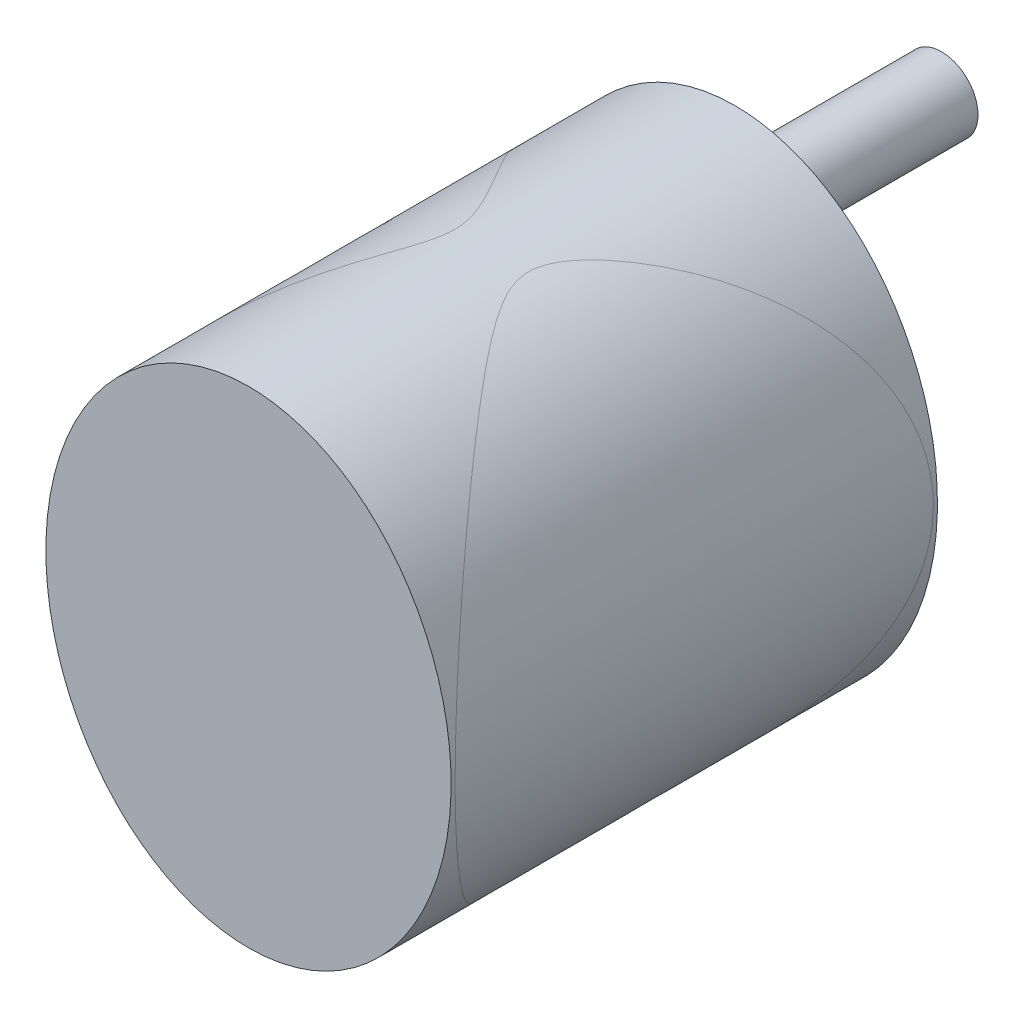
from build123d import *

# Parameters (mm, degrees)
ESQUISSE1_RX                 = 3
ESQUISSE1_RY                 = 2.5
EXTRUSION1_DEPTH             = 6
FRACTIONNER3_SURFACE_1_BACK  = 10.849
FRACTIONNER3_SURFACE_1_DEPTH = 21.698
FRACTIONNER3_SURFACE_2_BACK  = 10.849
FRACTIONNER3_SURFACE_2_DEPTH = 21.698
EXTRUSION3_REACH             = 10.902
ESQUISSE3_R                  = 0.45


with BuildPart() as part:
    # Esquisse1 → Extrusion1 (new body)
    with BuildSketch(Plane.XY):
        with Locations(Location((0, 0), (0, 0, 90))):
            Ellipse(ESQUISSE1_RX, ESQUISSE1_RY)
    extrude(amount=EXTRUSION1_DEPTH)


with BuildPart() as body_2:
    # Fractionner3: the piece behind the surface
    add(part.part)
    # Fractionner3 surface: a surface, the sketch's curves swept straight by 21.698 mm
    with BuildLine(Plane(origin=(0, 0, 0), x_dir=(0, 0, -1), z_dir=(1, 0, 0)).offset(-FRACTIONNER3_SURFACE_1_BACK), mode=Mode.PRIVATE) as fractionner3_surface_1_path:
        CenterArc((-3, 0), 2.95, 0, 360)
    fractionner3_surface_1 = Shell.extrude(fractionner3_surface_1_path.wire(), (1 * FRACTIONNER3_SURFACE_1_DEPTH, 0 * FRACTIONNER3_SURFACE_1_DEPTH, 0 * FRACTIONNER3_SURFACE_1_DEPTH))
    split(bisect_by=fractionner3_surface_1, keep=Keep.BOTTOM)


with BuildPart() as part_1:
    add(part.part)

    # Fractionner3: split by a surface, the side it looks to stays
    # Fractionner3 surface: a surface, the sketch's curves swept straight by 21.698 mm
    with BuildLine(Plane(origin=(0, 0, 0), x_dir=(0, 0, -1), z_dir=(1, 0, 0)).offset(-FRACTIONNER3_SURFACE_2_BACK), mode=Mode.PRIVATE) as fractionner3_surface_2_path:
        CenterArc((-3, 0), 2.95, 0, 360)
    fractionner3_surface_2 = Shell.extrude(fractionner3_surface_2_path.wire(), (1 * FRACTIONNER3_SURFACE_2_DEPTH, 0 * FRACTIONNER3_SURFACE_2_DEPTH, 0 * FRACTIONNER3_SURFACE_2_DEPTH))
    split(bisect_by=fractionner3_surface_2, keep=Keep.TOP)

    # Esquisse3 → Extrusion3 (add, up to next)
    with BuildSketch(Plane.XY.offset(-2), mode=Mode.PRIVATE) as extrusion3_sk1:
        with Locations(Location((0.55, 2.4, 0), (0, 0, 180))):
            Circle(ESQUISSE3_R)
    extrusion3_tool1 = extrude(extrusion3_sk1.sketch, amount=EXTRUSION3_REACH, mode=Mode.PRIVATE) - part_1.part
    # Esquisse3 → Extrusion3 (add, up to next)
    with BuildSketch(Plane.XY.offset(-2), mode=Mode.PRIVATE) as extrusion3_sk2:
        with Locations(Location((-0.55, -2.4, 0), (0, 0, 180))):
            Circle(ESQUISSE3_R)
    extrusion3_tool2 = extrude(extrusion3_sk2.sketch, amount=EXTRUSION3_REACH, mode=Mode.PRIVATE) - part_1.part
    add(extrusion3_tool1.solids().sort_by_distance((0.55, 2.4, -2))[0])
    add(extrusion3_tool2.solids().sort_by_distance((-0.55, -2.4, -2))[0])


solid = Compound([body_2.part, part_1.part])
